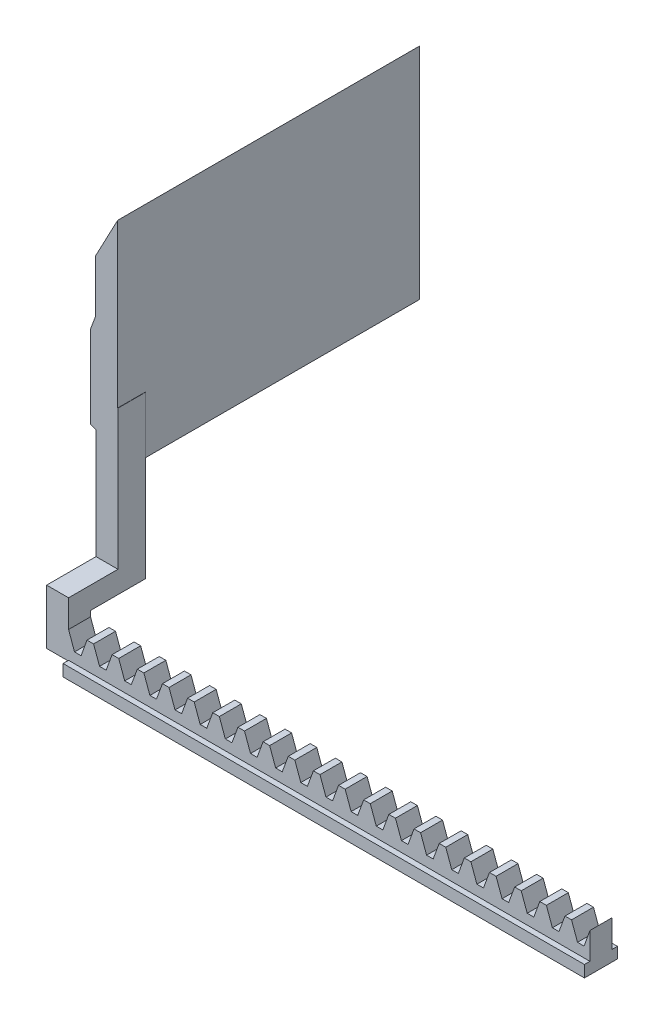
from build123d import *

# Parameters (mm, degrees)
BOSS_EXTRU_1_DEPTH      = 4
ESQUISSE2_W             = 1
ESQUISSE2_H             = 2
ESQUISSE2_H_2           = 2.130975397
BOSS_EXTRU_2_DEPTH      = 95
ESQUISSE3_W             = 4
ESQUISSE3_H             = 10
BOSS_EXTRU_3_DEPTH      = 4
ESQUISSE4_W             = 10
ESQUISSE4_H             = 4
BOSS_EXTRU_4_DEPTH      = 4
ESQUISSE6_W             = 5
ESQUISSE6_H             = 29.43
BOSS_EXTRU_5_DEPTH      = 4
BOSS_EXTRU_6_DEPTH      = 50
BOSS_EXTRU_6_DEPTH_BACK = 5


with BuildPart() as part:
    # Esquisse1 → Boss.-Extru.1 (new body)
    with BuildSketch(Plane.XY):
        Polygon((0.6, 0), (-0.6, 0), (-1.691910703, 3), (-2.891910703, 3), (-3.983821406, 0), (-5.183821406, 0), (-6.275732108, 3), (-7.475732108, 3), (-8.567642811, 0), (-9.767642811, 0), (-10.859553514, 3), (-12.059553514, 3), (-13.151464217, 0), (-14.351464217, 0), (-15.44337492, 3), (-16.64337492, 3), (-17.735285622, 0), (-18.935285622, 0), (-20.027196325, 3), (-21.227196325, 3), (-22.319107028, 0), (-23.519107028, 0), (-24.611017731, 3), (-25.811017731, 3), (-26.902928434, 0), (-28.102928434, 0), (-29.194839136, 3), (-30.394839136, 3), (-31.486749839, 0), (-32.686749839, 0), (-33.778660542, 3), (-34.978660542, 3), (-36.070571245, 0), (-37.270571245, 0), (-38.362481948, 3), (-39.562481948, 3), (-40.65439265, 0), (-41.85439265, 0), (-42.946303353, 3), (-44.146303353, 3), (-45.221021012, -0.00977063), (-46.4210099, -0.004606433), (-47.5, 3.000064821), (-47.5, -4), (47.5, -4), (47.5, 3.000064821), (46.438214056, 0), (45.238214056, 0), (44.146303353, 3), (42.946303353, 3), (41.85439265, 0), (40.65439265, 0), (39.562481948, 3), (38.362481948, 3), (37.270571245, 0), (36.070571245, 0), (34.978660542, 3), (33.778660542, 3), (32.686749839, 0), (31.486749839, 0), (30.394839136, 3), (29.194839136, 3), (28.102928434, 0), (26.902928434, 0), (25.811017731, 3), (24.611017731, 3), (23.519107028, 0), (22.319107028, 0), (21.227196325, 3), (20.027196325, 3), (18.935285622, 0), (17.735285622, 0), (16.64337492, 3), (15.44337492, 3), (14.351464217, 0), (13.151464217, 0), (12.059553514, 3), (10.859553514, 3), (9.767642811, 0), (8.567642811, 0), (7.475732108, 3), (6.275732108, 3), (5.183821406, 0), (3.983821406, 0), (2.891910703, 3), (1.691910703, 3), align=None)
    extrude(amount=-BOSS_EXTRU_1_DEPTH)

    # Esquisse2 → Boss.-Extru.2 (add)
    with BuildSketch(Plane.ZY.offset(47.5)):
        with Locations((-4.5, -3)):
            Rectangle(ESQUISSE2_W, ESQUISSE2_H)
        with Locations((0.5, -2.934512301)):
            Rectangle(ESQUISSE2_W, ESQUISSE2_H_2)
    extrude(amount=-BOSS_EXTRU_2_DEPTH)

    # Esquisse3 → Boss.-Extru.3 (add)
    with BuildSketch(Plane(origin=(0, 0, -4), x_dir=(-1, 0, 0), z_dir=(0, 0, -1))):
        with Locations((49.5, 3)):
            Rectangle(ESQUISSE3_W, ESQUISSE3_H)
    extrude(amount=-BOSS_EXTRU_3_DEPTH)

    # Esquisse4 → Boss.-Extru.4 (add)
    with BuildSketch(Plane.ZY.offset(51.5)):
        with Locations((-9, 6)):
            Rectangle(ESQUISSE4_W, ESQUISSE4_H)
    extrude(amount=-BOSS_EXTRU_4_DEPTH)

    # Esquisse6 → Boss.-Extru.5 (add)
    with BuildSketch(Plane.ZY.offset(51.5)):
        with Locations((-11.5, 18.715)):
            Rectangle(ESQUISSE6_W, ESQUISSE6_H)
    extrude(amount=-BOSS_EXTRU_5_DEPTH)

    # Esquisse7 → Boss.-Extru.6 (add, two sides: drawn at the far end of the back side and taken through both)
    with BuildSketch(Plane(origin=(0, 0, -14), x_dir=(-1, 0, 0), z_dir=(0, 0, -1)).offset(-BOSS_EXTRU_6_DEPTH_BACK)):
        Polygon((47.543968479, 63.053350001), (47.543968479, 23.053350001), (51.550036892, 28.053350001), (52.543968479, 28.423350001), (52.543968479, 43.303350001), (51.550036892, 45.973350001), (51.550036892, 55.49434682), align=None)
    extrude(amount=BOSS_EXTRU_6_DEPTH + BOSS_EXTRU_6_DEPTH_BACK)


solid = part.part
